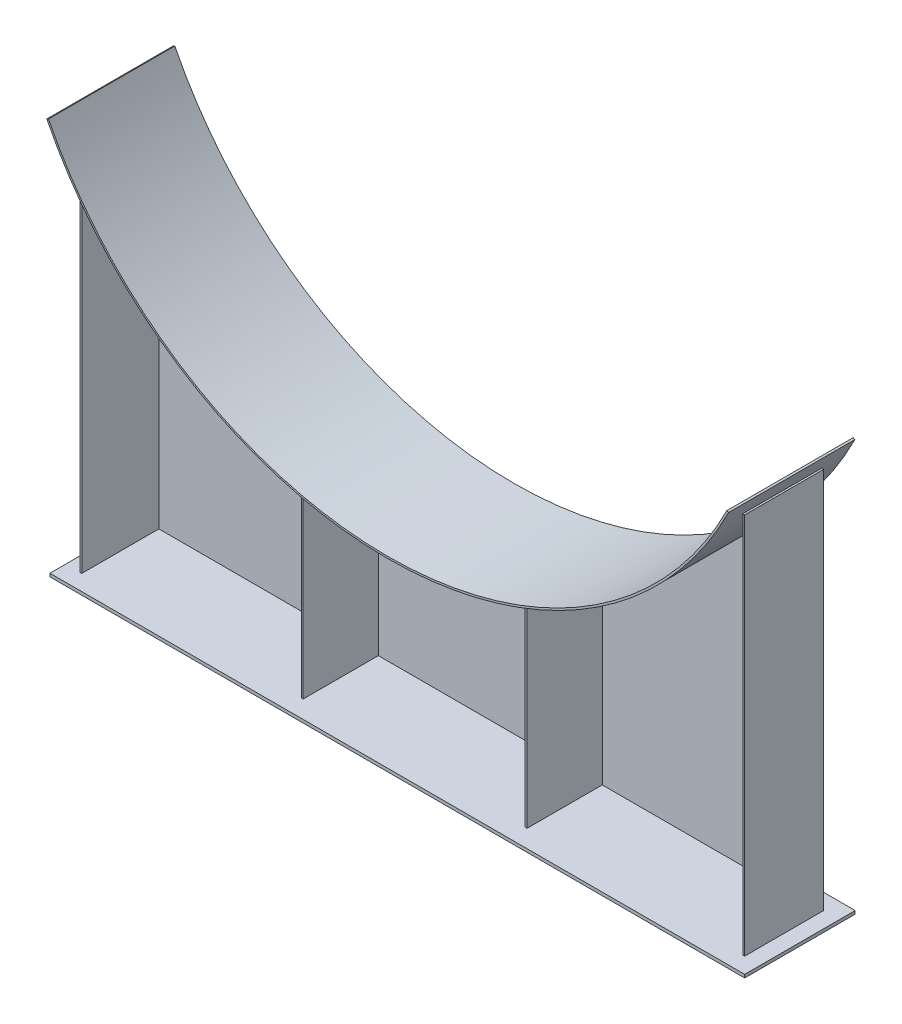
from build123d import *

# Parameters (mm, degrees)
BOSS_EXTRUDE1_DEPTH  = 1210
CUT_EXTRUDE1_DEPTH   = 2441.824655726
SKETCH4_W            = 2200
SKETCH4_H            = 350
BOSS_EXTRUDE2_DEPTH  = 10
BOSS_EXTRUDE14_START = 75
BOSS_EXTRUDE14_DEPTH = 400


with BuildPart() as part:
    # Sketch2 → Boss-Extrude1 (new body)
    with BuildSketch(Plane(origin=(0, 0, 0), x_dir=(1, 0, 0), z_dir=(0, 1, 0))):
        Polygon((0, 0), (0, 250), (1052.5, 250), (2105, 250), (2105, 0), (2099, 0), (2099, 244), (1410, 244), (1410, 6), (1404, 6), (1404, 244), (1052.5, 244), (701, 244), (701, 6), (695, 6), (695, 244), (6, 244), (6, 0), align=None)
    extrude(amount=BOSS_EXTRUDE1_DEPTH)

    # Sketch3 → Cut-Extrude1 (cut, through all)
    with BuildSketch(Plane(origin=(0, 0, -250), x_dir=(-1, 0, 0), z_dir=(0, 0, -1))):
        with BuildLine():
            Line((0, 1210), (-2099, 1210))
            ThreePointArc((-2099, 1210), (-1049.5, 599.996274287), (0, 1210))
        make_face()
    extrude(amount=-CUT_EXTRUDE1_DEPTH, mode=Mode.SUBTRACT)

    # Sketch4 → Boss-Extrude2 (add)
    with BuildSketch(Plane(origin=(0, 0, 0), x_dir=(1, 0, 0), z_dir=(0, 1, 0))):
        with Locations((1055, 125)):
            Rectangle(SKETCH4_W, SKETCH4_H)
    extrude(amount=-BOSS_EXTRUDE2_DEPTH)


with BuildPart() as body_2:
    # Sketch10 → Boss-Extrude14 (new body)
    with BuildSketch(Plane(origin=(0, 0, -250), x_dir=(-1, 0, 0), z_dir=(0, 0, -1)).offset(BOSS_EXTRUDE14_START)):
        with BuildLine():
            Line((29.866493343, 1265.780284504), (24.504622164, 1268.472929571))
            ThreePointArc((24.504622164, 1268.472929571), (-1049.574185027, 605.996276577), (-2123.571198629, 1268.605523867))
            Line((-2123.571198629, 1268.605523867), (-2128.933402185, 1265.913540765))
            ThreePointArc((-2128.933402185, 1265.913540765), (-1049.574555389, 599.996276588), (29.866493343, 1265.780284504))
        make_face()
    extrude(amount=-BOSS_EXTRUDE14_DEPTH)


solid = Compound([part.part, body_2.part])
